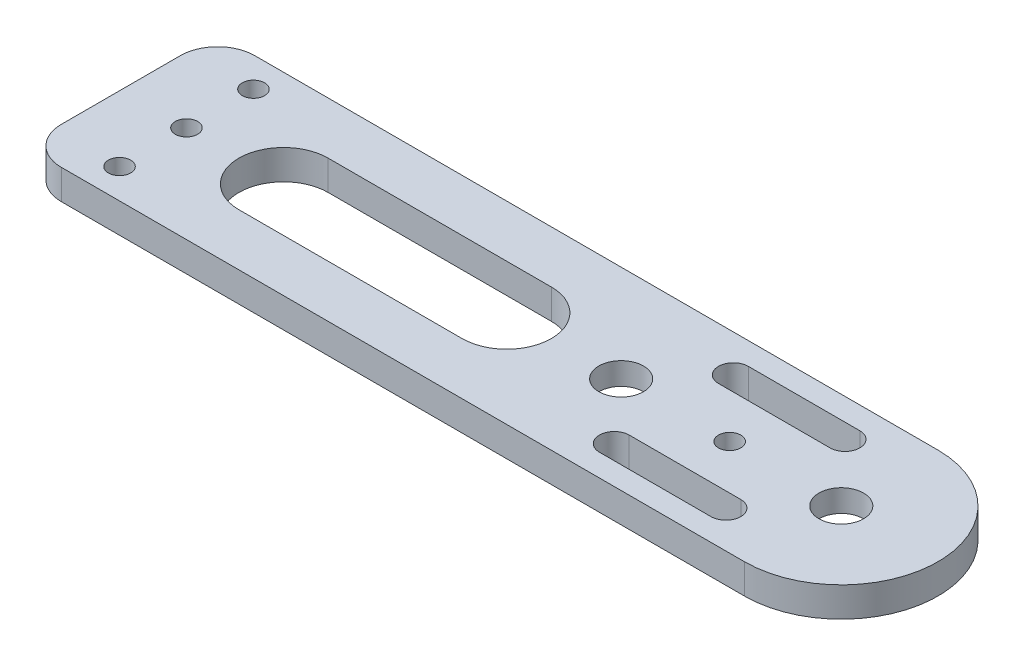
from build123d import *

# Parameters (mm, degrees)
SKETCH_1_R          = 5
SKETCH_1_R_2        = 3
SKETCH_1_R_3        = 1.3
SKETCH_1_R_4        = 1.5
SKETCH_1_W          = 5
SKETCH_1_H          = 10
EXTRUDE_1_DEPTH     = 4
SKETCH_2_R          = 6.01
CUT_EXTRUDE_1_DEPTH = 1
SKETCH_4_W          = 81.277296146
SKETCH_4_H          = 46.186139701
CUT_EXTRUDE_4_DEPTH = 16
FILLET_1_R          = 5


with BuildPart() as part:
    # 草图1 → 凸台-拉伸1 (new body)
    with BuildSketch(Plane(origin=(0, 0, 0), x_dir=(1, 0, 0), z_dir=(0, 1, 0))):
        with BuildLine():
            Line((150, 13), (15.198684154, 13))
            ThreePointArc((15.198684154, 13), (-20, 0), (15.198684154, -13))
            Line((15.198684154, -13), (150, -13))
            ThreePointArc((150, -13), (163, 0), (150, 13))
        make_face()
        with Locations(Location((0, 0, 0), (0, 0, 270))):
            Circle(SKETCH_1_R, mode=Mode.SUBTRACT)
        with Locations(Location((150, 0, 0), (0, 0, 270))):
            Circle(SKETCH_1_R_2, mode=Mode.SUBTRACT)
        with Locations(Location((120.4195, 0, 0), (0, 0, 270))):
            Circle(SKETCH_1_R_2, mode=Mode.SUBTRACT)
        with Locations(Location((0, 9, 0), (0, 0, 270))):
            Circle(SKETCH_1_R_3, mode=Mode.SUBTRACT)
        with Locations(Location((7.794228634, -4.5, 0), (0, 0, 270))):
            Circle(SKETCH_1_R_3, mode=Mode.SUBTRACT)
        with Locations(Location((-7.794228634, -4.5, 0), (0, 0, 270))):
            Circle(SKETCH_1_R_3, mode=Mode.SUBTRACT)
        with Locations(Location((135, 0, 0), (0, 0, 270))):
            Circle(SKETCH_1_R_4, mode=Mode.SUBTRACT)
        with Locations(Location((62, 0, 0), (0, 0, 270))):
            Circle(SKETCH_1_R_4, mode=Mode.SUBTRACT)
        with Locations(Location((62, 9, 0), (0, 0, 270))):
            Circle(SKETCH_1_R_4, mode=Mode.SUBTRACT)
        with Locations(Location((62, -9, 0), (0, 0, 270))):
            Circle(SKETCH_1_R_4, mode=Mode.SUBTRACT)
        with Locations((0, -11.773380776)):
            Rectangle(SKETCH_1_W, SKETCH_1_H, mode=Mode.SUBTRACT)
        with BuildLine():
            Line((105.041482469, -6), (75.041482469, -6))
            ThreePointArc((75.041482469, -6), (69.041482469, 0), (75.041482469, 6))
            Line((75.041482469, 6), (105.041482469, 6))
            ThreePointArc((105.041482469, 6), (111.041482469, 0), (105.041482469, -6))
        make_face(mode=Mode.SUBTRACT)
        with BuildLine():
            Line((142.5, 6), (127.5, 6))
            ThreePointArc((127.5, 6), (125.5, 8), (127.5, 10))
            Line((127.5, 10), (142.5, 10))
            ThreePointArc((142.5, 10), (144.5, 8), (142.5, 6))
        make_face(mode=Mode.SUBTRACT)
        with BuildLine():
            Line((142.5, -6), (127.5, -6))
            ThreePointArc((127.5, -6), (125.5, -8), (127.5, -10))
            Line((127.5, -10), (142.5, -10))
            ThreePointArc((142.5, -10), (144.5, -8), (142.5, -6))
        make_face(mode=Mode.SUBTRACT)
    extrude(amount=EXTRUDE_1_DEPTH)

    # 草图2 → 切除-拉伸1 (cut)
    with BuildSketch(Plane.XZ):
        with Locations(Location((150, 0, 0), (0, 0, 270))):
            Circle(SKETCH_2_R)
        with Locations(Location((120.4195, 0, 0), (0, 0, 270))):
            Circle(SKETCH_2_R)
    extrude(amount=-CUT_EXTRUDE_1_DEPTH, mode=Mode.SUBTRACT)

    # 草图4 → 切除-拉伸4 (cut)
    with BuildSketch(Plane(origin=(0, 4, 0), x_dir=(1, 0, 0), z_dir=(0, 1, 0))):
        with Locations((12.539593114, -0.049090765)):
            Rectangle(SKETCH_4_W, SKETCH_4_H)
    extrude(amount=-CUT_EXTRUDE_4_DEPTH, mode=Mode.SUBTRACT)

    # 圆角1
    fillet_1_edges = [part.edges().sort_by_distance(p)[0] for p in [
        (53.178241187, 2, 13),
        (53.178241187, 2, -13),
    ]]
    fillet(fillet_1_edges, radius=FILLET_1_R)


solid = part.part
